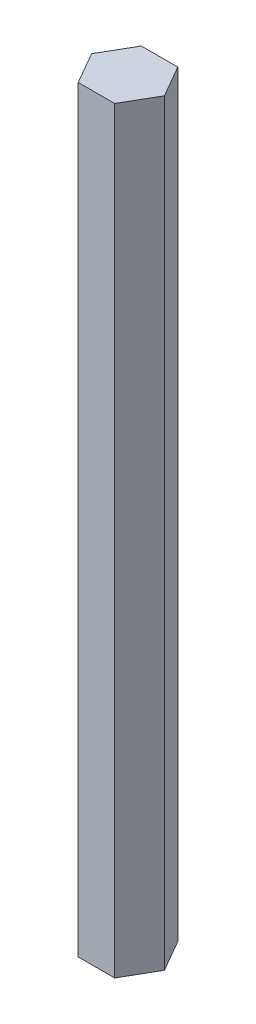
from build123d import *

# Parameters (mm, degrees)
BOSS_EXTRUDE1_DEPTH = 152.4


with BuildPart() as part:
    # Sketch1 → Boss-Extrude1 (new body)
    with BuildSketch(Plane(origin=(0, 0, 0), x_dir=(1, 0, 0), z_dir=(0, 1, 0))):
        Polygon((7.332348419, 0), (3.666174209, 6.35), (-3.666174209, 6.35), (-7.332348419, 0), (-3.666174209, -6.35), (3.666174209, -6.35), align=None)
    extrude(amount=BOSS_EXTRUDE1_DEPTH)


solid = part.part
